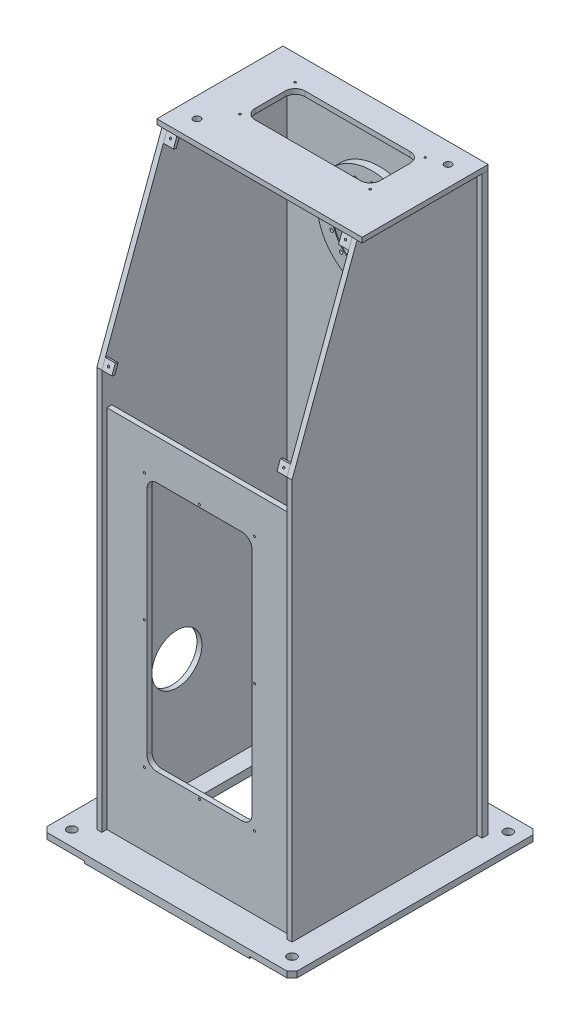
from build123d import *

# Parameters (mm, degrees)
SKETCH_1_W                   = 410
SKETCH_1_H                   = 1150
EXTRUDE_1_DEPTH              = 12
SKETCH_2_W                   = 10
SKETCH_2_H                   = 1150
EXTRUDE_2_DEPTH              = 370
EXTRUDE_2_2_DEPTH            = 370
SKETCH_3_R                   = 110
CUT_EXTRUDE_1_DEPTH          = 400
EXTRUDE_3_DEPTH              = 15
EXTRUDE_3_DEPTH_BACK         = 12
SKETCH_4_R                   = 110
SKETCH_4_R_2                 = 80
SKETCH_7_W                   = 3.4
SKETCH_7_H                   = 27
PATTERN_CIRCULAR_1_COUNT     = 16
SKETCH_9_W                   = 500
SKETCH_9_H                   = 492
EXTRUDE_4_DEPTH              = 16
SKETCH_10_W                  = 300
SKETCH_10_H                  = 250
CUT_EXTRUDE_2_DEPTH          = 16
CHAMFER_1_SIZE               = 10
FILLET_1_R                   = 20
SKETCH_11_W                  = 8
SKETCH_11_H                  = 69
EXTRUDE_5_DEPTH              = 150
EXTRUDE_5_2_DEPTH            = 150
CUT_EXTRUDE_START            = -283
CUT_EXTRUDE_3_DEPTH          = 410
CUT_EXTRUDE_4_DEPTH          = 860.229305832
SKETCH_14_W                  = 370
SKETCH_14_H                  = 10
EXTRUDE_6_DEPTH              = 730
SKETCH_15_W                  = 410
SKETCH_15_H                  = 252
EXTRUDE_7_DEPTH              = 10
SKETCH_16_W                  = 210
SKETCH_16_H                  = 500
CUT_EXTRUDE_5_DEPTH          = 10
CHAMFER_3_SIZE               = 1
SKETCH_17_W                  = 250
SKETCH_17_H                  = 100
CUT_EXTRUDE_6_DEPTH          = 10
FILLET_2_R                   = 20
SKETCH_21_R                  = 9
CUT_EXTRUDE_8_DEPTH          = 1265.543000455
HOLE_WIZARD_M5_1_AT_2_COUNT  = 2
HOLE_WIZARD_M5_1_AT_2_PITCH  = 255
HOLE_WIZARD_M5_1_AT_3_COUNT  = 2
HOLE_WIZARD_M5_1_AT_3_PITCH  = 510
HOLE_WIZARD_M5_1_AT_4_COUNT  = 2
HOLE_WIZARD_M5_1_AT_4_PITCH  = 521.72789843
HOLE_WIZARD_M5_1_AT_5_COUNT  = 2
HOLE_WIZARD_M5_1_AT_5_PITCH  = 555.42776308
HOLE_WIZARD_M5_1_AT_6_COUNT  = 2
HOLE_WIZARD_M5_1_AT_6_PITCH  = 336.786282381
HOLE_WIZARD_M5_1_AT_7_COUNT  = 2
HOLE_WIZARD_M5_1_AT_7_PITCH  = 220
HOLE_WIZARD_M5_1_AT_8_COUNT  = 2
HOLE_WIZARD_M5_1_AT_8_PITCH  = 110
FILLET_3_R                   = 20
HOLE_WIZARD_M5_2_AT_2_COUNT  = 2
HOLE_WIZARD_M5_2_AT_2_PITCH  = 110
HOLE_WIZARD_M5_2_AT_3_COUNT  = 2
HOLE_WIZARD_M5_2_AT_3_PITCH  = 282.31188427
HOLE_WIZARD_M5_2_AT_4_COUNT  = 2
HOLE_WIZARD_M5_2_AT_4_PITCH  = 260
HOLE_WIZARD_M16_1_AT_2_COUNT = 2
HOLE_WIZARD_M16_1_AT_2_PITCH = 372.134384329
SKETCH_31_W                  = 40
SKETCH_31_H                  = 30
EXTRUDE_8_DEPTH              = 10
EXTRUDE_8_2_DEPTH            = 10
HOLE_WIZARD_M16_3_AT_2_COUNT = 2
HOLE_WIZARD_M16_3_AT_2_PITCH = 372.832034102
SKETCH_41_R                  = 50
CUT_EXTRUDE_10_DEPTH         = 855.093086262
SKETCH_40_OUTSIDE_W          = 775.864
SKETCH_40_OUTSIDE_H          = 767.864
SKETCH_40_OUTSIDE_W_2        = 330
SKETCH_40_OUTSIDE_H_2        = 492
CUT_EXTRUDE_9_DEPTH          = 4
SKETCH_42_W                  = 20
SKETCH_42_H                  = 20
EXTRUDE_9_DEPTH              = 6
EXTRUDE_9_2_DEPTH            = 6
EXTRUDE_9_3_DEPTH            = 6
EXTRUDE_9_4_DEPTH            = 6
HOLE_WIZARD_M5_3_AT_2_COUNT  = 2
HOLE_WIZARD_M5_3_AT_2_PITCH  = 355
HOLE_WIZARD_M5_3_AT_3_COUNT  = 2
HOLE_WIZARD_M5_3_AT_3_PITCH  = 498.522817933
HOLE_WIZARD_M5_3_AT_4_COUNT  = 2
HOLE_WIZARD_M5_3_AT_4_PITCH  = 350


with BuildPart() as part:
    # 草图1 → 凸台-拉伸1 (new body)
    with BuildSketch(Plane.XY):
        Rectangle(SKETCH_1_W, SKETCH_1_H)
    extrude(amount=EXTRUDE_1_DEPTH)

    # 草图3 → 切除-拉伸1 (cut)
    with BuildSketch(Plane(origin=(0, 0, 0), x_dir=(-1, 0, 0), z_dir=(0, 0, -1))):
        with Locations((0, 375)):
            Circle(SKETCH_3_R)
    extrude(amount=-CUT_EXTRUDE_1_DEPTH, mode=Mode.SUBTRACT)


with BuildPart() as body_2:
    # 草图2 → 凸台-拉伸2 (new body)
    with BuildSketch(Plane.XY.offset(12)):
        with Locations((190, 0)):
            Rectangle(SKETCH_2_W, SKETCH_2_H)
    extrude(amount=EXTRUDE_2_DEPTH)


with BuildPart() as body_3:
    # 草图2 → Extrude 2 2 (new body)
    with BuildSketch(Plane.XY.offset(12)):
        with Locations((-190, 0)):
            Rectangle(SKETCH_2_W, SKETCH_2_H)
    extrude(amount=EXTRUDE_2_2_DEPTH)


with BuildPart() as body_4:
    # 草图4 → 凸台-拉伸3 (new, two sides: drawn at the far end of the back side and taken through both)
    with BuildSketch(Plane.XY.offset(12).offset(-EXTRUDE_3_DEPTH_BACK)):
        with Locations((0, 375)):
            Circle(SKETCH_4_R)
        with Locations((0, 375)):
            Circle(SKETCH_4_R_2, mode=Mode.SUBTRACT)
    extrude(amount=EXTRUDE_3_DEPTH + EXTRUDE_3_DEPTH_BACK)

    # 草图7 → M8 螺纹孔1 (revolve, cut)
    with BuildSketch(Plane(origin=(0, 462.5, 27), x_dir=(0, -1, 0), z_dir=(1, 0, 0))):
        with Locations((1.7, 13.5)):
            Rectangle(SKETCH_7_W, SKETCH_7_H)
    hole_wizard_m8_1 = revolve(axis=Axis((0, 462.5, 33.35), (0, 0, -1)), mode=Mode.SUBTRACT)

    # 阵列(圆周)1: M8 螺纹孔1 ×16 about axis
    pattern_circular_1_axis = Axis((0, 375, 0), (0, 0, 1))
    for i in range(1, PATTERN_CIRCULAR_1_COUNT):
        add(hole_wizard_m8_1.rotate(pattern_circular_1_axis, i * 360 / PATTERN_CIRCULAR_1_COUNT), mode=Mode.SUBTRACT)

    # 倒角3
    chamfer_3_edges = [body_4.edges().sort_by_distance(p)[0] for p in [
        (-80, 375, 27),
    ]]
    chamfer(chamfer_3_edges, length=CHAMFER_3_SIZE)


with BuildPart() as body_5:
    # 草图9 → 凸台-拉伸4 (new body)
    with BuildSketch(Plane.XZ.offset(575)):
        with Locations((0, 191)):
            Rectangle(SKETCH_9_W, SKETCH_9_H)
    extrude(amount=EXTRUDE_4_DEPTH)

    # 草图10 → 切除-拉伸2 (cut)
    with BuildSketch(Plane.XZ.offset(591)):
        with Locations((0, 206)):
            Rectangle(SKETCH_10_W, SKETCH_10_H)
    extrude(amount=-CUT_EXTRUDE_2_DEPTH, mode=Mode.SUBTRACT)

    # 倒角1
    chamfer_1_edges = [body_5.edges().sort_by_distance(p)[0] for p in [
        (-250, -583, 437),
        (250, -583, 437),
        (250, -583, -55),
        (-250, -583, -55),
    ]]
    chamfer(chamfer_1_edges, length=CHAMFER_1_SIZE)

    # 圆角1
    fillet_1_edges = [body_5.edges().sort_by_distance(p)[0] for p in [
        (150, -583, 331),
        (150, -583, 81),
        (-150, -583, 81),
        (-150, -583, 331),
    ]]
    fillet(fillet_1_edges, radius=FILLET_1_R)

    # 草图21 → 切除-拉伸8 (cut, through all)
    with BuildSketch(Plane(origin=(0, -575, 0), x_dir=(1, 0, 0), z_dir=(0, 1, 0))):
        with Locations(Location((-220, 25, 0), (0, 0, 270))):
            Circle(SKETCH_21_R)
        with Locations(Location((-220, -407, 0), (0, 0, 270))):
            Circle(SKETCH_21_R)
        with Locations(Location((220, -407, 0), (0, 0, 270))):
            Circle(SKETCH_21_R)
        with Locations(Location((220, 25, 0), (0, 0, 270))):
            Circle(SKETCH_21_R)
    extrude(amount=-CUT_EXTRUDE_8_DEPTH, mode=Mode.SUBTRACT)

    # 草图40 outside → 切除-拉伸9 (cut)
    with BuildSketch(Plane.XZ.offset(591)):
        with Locations((0, 191)):
            Rectangle(SKETCH_40_OUTSIDE_W, SKETCH_40_OUTSIDE_H)
        with Locations((0, 191)):
            Rectangle(SKETCH_40_OUTSIDE_W_2, SKETCH_40_OUTSIDE_H_2, mode=Mode.SUBTRACT)
    extrude(amount=-CUT_EXTRUDE_9_DEPTH, mode=Mode.SUBTRACT)


with BuildPart() as body_6:
    # 草图11 → 凸台-拉伸5 (new body)
    with BuildSketch(Plane(origin=(0, -575, 0), x_dir=(1, 0, 0), z_dir=(0, 1, 0))):
        with Locations((-74, -46.5)):
            Rectangle(SKETCH_11_W, SKETCH_11_H)
    extrude(amount=EXTRUDE_5_DEPTH)


with BuildPart() as body_7:
    # 草图11 → Extrude 5 2 (new body)
    with BuildSketch(Plane(origin=(0, -575, 0), x_dir=(1, 0, 0), z_dir=(0, 1, 0))):
        with Locations((74, -46.5)):
            Rectangle(SKETCH_11_W, SKETCH_11_H)
    extrude(amount=EXTRUDE_5_2_DEPTH)


with BuildPart() as cut_extrude_3_tool:
    # 草图12 → 切除-拉伸3 (new body)
    with BuildSketch(Plane(origin=(78, 0, 0), x_dir=(0, 0, -1), z_dir=(1, 0, 0)).offset(CUT_EXTRUDE_START)):
        Polygon((-12, -575), (-12, -495), (-17, -575), align=None)
        Polygon((-81, -480), (-31, -425), (-81, -425), align=None)
    extrude(amount=CUT_EXTRUDE_3_DEPTH)


with BuildPart() as body_6_1:
    add(body_6.part)

    # 切除-拉伸3: cut by cut_extrude_3_tool
    add(cut_extrude_3_tool.part, mode=Mode.SUBTRACT)


with BuildPart() as body_7_1:
    add(body_7.part)

    # 切除-拉伸3: cut by cut_extrude_3_tool
    add(cut_extrude_3_tool.part, mode=Mode.SUBTRACT)


with BuildPart() as cut_extrude_4_tool:
    # 草图13 → 切除-拉伸4 (new, through all)
    with BuildSketch(Plane(origin=(195, 0, 0), x_dir=(0, 0, -1), z_dir=(1, 0, 0))):
        Polygon((-252, 575), (-382, 575), (-382, 225), align=None)
    extrude(amount=-CUT_EXTRUDE_4_DEPTH)


with BuildPart() as body_2_1:
    add(body_2.part)

    # 切除-拉伸4: cut by cut_extrude_4_tool
    add(cut_extrude_4_tool.part, mode=Mode.SUBTRACT)


with BuildPart() as body_3_1:
    add(body_3.part)

    # 切除-拉伸4: cut by cut_extrude_4_tool
    add(cut_extrude_4_tool.part, mode=Mode.SUBTRACT)

    # 草图41 → 切除-拉伸10 (cut, through all)
    with BuildSketch(Plane(origin=(-185, 0, 0), x_dir=(0, 0, -1), z_dir=(1, 0, 0))):
        with Locations((-232, -350)):
            Circle(SKETCH_41_R)
    extrude(amount=-CUT_EXTRUDE_10_DEPTH, mode=Mode.SUBTRACT)


with BuildPart() as body_8:
    # 草图14 → 凸台-拉伸6 (new body)
    with BuildSketch(Plane(origin=(0, -575, 0), x_dir=(1, 0, 0), z_dir=(0, 1, 0))):
        with Locations((0, -367)):
            Rectangle(SKETCH_14_W, SKETCH_14_H)
    extrude(amount=EXTRUDE_6_DEPTH)

    # 草图16 → 切除-拉伸5 (cut)
    with BuildSketch(Plane.XY.offset(372)):
        with Locations((0, -175)):
            Rectangle(SKETCH_16_W, SKETCH_16_H)
    extrude(amount=-CUT_EXTRUDE_5_DEPTH, mode=Mode.SUBTRACT)

    # 草图22 → M5 螺纹孔1 (revolve, cut)
    with BuildSketch(Plane(origin=(-110, 80, 372), x_dir=(0, -1, 0), z_dir=(1, 0, 0))):
        Polygon((0, 0), (0, 13.6618073), (2.1, 12.4), (2.1, 0), align=None)
    hole_wizard_m5_1 = revolve(axis=Axis((-110, 80, 378.35), (0, 0, -1)), mode=Mode.SUBTRACT)

    # M5 螺纹孔1 at 2: M5 螺纹孔1 ×2
    with Locations(*[(0, -i * HOLE_WIZARD_M5_1_AT_2_PITCH, 0) for i in range(1, HOLE_WIZARD_M5_1_AT_2_COUNT)]):
        add(hole_wizard_m5_1, mode=Mode.SUBTRACT)

    # M5 螺纹孔1 at 3: M5 螺纹孔1 ×2
    with Locations(*[(0, -i * HOLE_WIZARD_M5_1_AT_3_PITCH, 0) for i in range(1, HOLE_WIZARD_M5_1_AT_3_COUNT)]):
        add(hole_wizard_m5_1, mode=Mode.SUBTRACT)

    # M5 螺纹孔1 at 4: M5 螺纹孔1 ×2
    with Locations(*[Vector(0.21083787225305148, -0.9775210440823288, 0) * (i * HOLE_WIZARD_M5_1_AT_4_PITCH) for i in range(1, HOLE_WIZARD_M5_1_AT_4_COUNT)]):
        add(hole_wizard_m5_1, mode=Mode.SUBTRACT)

    # M5 螺纹孔1 at 5: M5 螺纹孔1 ×2
    with Locations(*[Vector(0.3960911114346505, -0.9182112128712344, 0) * (i * HOLE_WIZARD_M5_1_AT_5_PITCH) for i in range(1, HOLE_WIZARD_M5_1_AT_5_COUNT)]):
        add(hole_wizard_m5_1, mode=Mode.SUBTRACT)

    # M5 螺纹孔1 at 6: M5 螺纹孔1 ×2
    with Locations(*[Vector(0.6532332565467511, -0.7571567291791882, 0) * (i * HOLE_WIZARD_M5_1_AT_6_PITCH) for i in range(1, HOLE_WIZARD_M5_1_AT_6_COUNT)]):
        add(hole_wizard_m5_1, mode=Mode.SUBTRACT)

    # M5 螺纹孔1 at 7: M5 螺纹孔1 ×2
    with Locations(*[(i * HOLE_WIZARD_M5_1_AT_7_PITCH, 0, 0) for i in range(1, HOLE_WIZARD_M5_1_AT_7_COUNT)]):
        add(hole_wizard_m5_1, mode=Mode.SUBTRACT)

    # M5 螺纹孔1 at 8: M5 螺纹孔1 ×2
    with Locations(*[(i * HOLE_WIZARD_M5_1_AT_8_PITCH, 0, 0) for i in range(1, HOLE_WIZARD_M5_1_AT_8_COUNT)]):
        add(hole_wizard_m5_1, mode=Mode.SUBTRACT)

    # 圆角3
    fillet_3_edges = [body_8.edges().sort_by_distance(p)[0] for p in [
        (105, 75, 367),
        (105, -425, 367),
        (-105, -425, 367),
        (-105, 75, 367),
    ]]
    fillet(fillet_3_edges, radius=FILLET_3_R)


with BuildPart() as body_9:
    # 草图15 → 凸台-拉伸7 (new body)
    with BuildSketch(Plane(origin=(0, 575, 0), x_dir=(1, 0, 0), z_dir=(0, 1, 0))):
        with Locations((0, -126)):
            Rectangle(SKETCH_15_W, SKETCH_15_H)
    extrude(amount=EXTRUDE_7_DEPTH)

    # 草图17 → 切除-拉伸6 (cut)
    with BuildSketch(Plane(origin=(0, 585, 0), x_dir=(1, 0, 0), z_dir=(0, 1, 0))):
        with Locations((0, -105.740281061)):
            Rectangle(SKETCH_17_W, SKETCH_17_H)
    extrude(amount=-CUT_EXTRUDE_6_DEPTH, mode=Mode.SUBTRACT)

    # 圆角2
    fillet_2_edges = [body_9.edges().sort_by_distance(p)[0] for p in [
        (125, 580, 55.740281061),
        (125, 580, 155.740281061),
        (-125, 580, 155.740281061),
        (-125, 580, 55.740281061),
    ]]
    fillet(fillet_2_edges, radius=FILLET_2_R)

    # 草图24 → M5 螺纹孔2 (revolve, cut)
    with BuildSketch(Plane(origin=(-130, 585, 160.740281061), x_dir=(0, 0, 1), z_dir=(1, 0, 0))):
        Polygon((0, 0), (0, 13.6618073), (2.1, 12.4), (2.1, 0), align=None)
    hole_wizard_m5_2 = revolve(axis=Axis((-130, 591.35, 160.740281061), (0, -1, 0)), mode=Mode.SUBTRACT)

    # M5 螺纹孔2 at 2: M5 螺纹孔2 ×2
    with Locations(*[(0, 0, -i * HOLE_WIZARD_M5_2_AT_2_PITCH) for i in range(1, HOLE_WIZARD_M5_2_AT_2_COUNT)]):
        add(hole_wizard_m5_2, mode=Mode.SUBTRACT)

    # M5 螺纹孔2 at 3: M5 螺纹孔2 ×2
    with Locations(*[Vector(0.9209672510685588, 0, -0.3896399908366981) * (i * HOLE_WIZARD_M5_2_AT_3_PITCH) for i in range(1, HOLE_WIZARD_M5_2_AT_3_COUNT)]):
        add(hole_wizard_m5_2, mode=Mode.SUBTRACT)

    # M5 螺纹孔2 at 4: M5 螺纹孔2 ×2
    with Locations(*[(i * HOLE_WIZARD_M5_2_AT_4_PITCH, 0, 0) for i in range(1, HOLE_WIZARD_M5_2_AT_4_COUNT)]):
        add(hole_wizard_m5_2, mode=Mode.SUBTRACT)

    # 草图26 → M16 螺纹孔1 (revolve, cut)
    with BuildSketch(Plane(origin=(-165, 585, 212), x_dir=(0, 0, 1), z_dir=(1, 0, 0))):
        Polygon((0, 0), (0, 42.206024333), (7, 38), (7, 0), align=None)
    hole_wizard_m16_1 = revolve(axis=Axis((-165, 591.35, 212), (0, -1, 0)), mode=Mode.SUBTRACT)

    # M16 螺纹孔1 at 2: M16 螺纹孔1 ×2
    with Locations(*[Vector(0.8867764278082937, 0, -0.4621986229788685) * (i * HOLE_WIZARD_M16_1_AT_2_PITCH) for i in range(1, HOLE_WIZARD_M16_1_AT_2_COUNT)]):
        add(hole_wizard_m16_1, mode=Mode.SUBTRACT)


with BuildPart() as body_10:
    # 草图31 → 凸台-拉伸8 (new body)
    with BuildSketch(Plane.XZ.offset(-575)):
        with Locations((-165, 212)):
            Rectangle(SKETCH_31_W, SKETCH_31_H)
    extrude(amount=EXTRUDE_8_DEPTH)


with BuildPart() as body_11:
    # 草图31 → Extrude 8 2 (new body)
    with BuildSketch(Plane.XZ.offset(-575)):
        with Locations((175, 40)):
            Rectangle(SKETCH_31_W, SKETCH_31_H)
    extrude(amount=EXTRUDE_8_2_DEPTH)

    # 草图36 → M16 螺纹孔3 (revolve, cut)
    with BuildSketch(Plane(origin=(165, 575, 38.495747452), x_dir=(0, 0, 1), z_dir=(1, 0, 0))):
        Polygon((0, 0), (0, 42.206024333), (7, 38), (7, 0), align=None)
    hole_wizard_m16_3 = revolve(axis=Axis((165, 581.35, 38.495747452), (0, -1, 0)), mode=Mode.SUBTRACT)


with BuildPart() as body_10_1:
    add(body_10.part)

    # M16 螺纹孔3 at 2: M16 螺纹孔3 ×2
    with Locations(*[Vector(-0.8851170763670309, 0, 0.46536841440248167) * (i * HOLE_WIZARD_M16_3_AT_2_PITCH) for i in range(1, HOLE_WIZARD_M16_3_AT_2_COUNT)]):
        add(hole_wizard_m16_3, mode=Mode.SUBTRACT)


with BuildPart() as body_12:
    # 草图42 → 凸台-拉伸9 (new body)
    with BuildSketch(Plane(origin=(0, 151.961979914, 409.128407461), x_dir=(1, 0, 0), z_dir=(0, 0.34818652960362717, 0.9374252720097654))):
        with Locations((-175, 441.276525946)):
            Rectangle(SKETCH_42_W, SKETCH_42_H)
    extrude(amount=-EXTRUDE_9_DEPTH)


with BuildPart() as body_13:
    # 草图42 → Extrude 9 2 (new body)
    with BuildSketch(Plane(origin=(0, 151.961979914, 409.128407461), x_dir=(1, 0, 0), z_dir=(0, 0.34818652960362717, 0.9374252720097654))):
        with Locations((-175, 87.913431894)):
            Rectangle(SKETCH_42_W, SKETCH_42_H)
    extrude(amount=-EXTRUDE_9_2_DEPTH)

    # 草图49 → M5 螺纹孔3 (revolve, cut)
    with BuildSketch(Plane(origin=(-175, 234.37425272, 378.518134704), x_dir=(0, -0.9374252720097652, 0.34818652960362767), z_dir=(1, 0, 0))):
        Polygon((0, 0), (0, 15.2618073), (2.1, 14), (2.1, 0), align=None)
    hole_wizard_m5_3 = revolve(axis=Axis((-175, 236.585237183, 384.470785181), (0, -0.34818652960362745, -0.9374252720097652)), mode=Mode.SUBTRACT)


with BuildPart() as body_14:
    # 草图42 → Extrude 9 3 (new body)
    with BuildSketch(Plane(origin=(0, 151.961979914, 409.128407461), x_dir=(1, 0, 0), z_dir=(0, 0.34818652960362717, 0.9374252720097654))):
        with Locations((175, 87.913431894)):
            Rectangle(SKETCH_42_W, SKETCH_42_H)
    extrude(amount=-EXTRUDE_9_3_DEPTH)

    # M5 螺纹孔3 at 4: M5 螺纹孔3 ×2
    with Locations(*[(i * HOLE_WIZARD_M5_3_AT_4_PITCH, 0, 0) for i in range(1, HOLE_WIZARD_M5_3_AT_4_COUNT)]):
        add(hole_wizard_m5_3, mode=Mode.SUBTRACT)


with BuildPart() as body_15:
    # 草图42 → Extrude 9 4 (new body)
    with BuildSketch(Plane(origin=(0, 151.961979914, 409.128407461), x_dir=(1, 0, 0), z_dir=(0, 0.34818652960362717, 0.9374252720097654))):
        with Locations((175, 441.276525946)):
            Rectangle(SKETCH_42_W, SKETCH_42_H)
    extrude(amount=-EXTRUDE_9_4_DEPTH)

    # M5 螺纹孔3 at 3: M5 螺纹孔3 ×2
    with Locations(*[Vector(0.7020741827848285, 0.6675441115076456, -0.24794495570284006) * (i * HOLE_WIZARD_M5_3_AT_3_PITCH) for i in range(1, HOLE_WIZARD_M5_3_AT_3_COUNT)]):
        add(hole_wizard_m5_3, mode=Mode.SUBTRACT)


with BuildPart() as body_12_1:
    add(body_12.part)

    # M5 螺纹孔3 at 2: M5 螺纹孔3 ×2
    with Locations(*[Vector(0, 0.9374252720097652, -0.34818652960362745) * (i * HOLE_WIZARD_M5_3_AT_2_PITCH) for i in range(1, HOLE_WIZARD_M5_3_AT_2_COUNT)]):
        add(hole_wizard_m5_3, mode=Mode.SUBTRACT)


solid = Compound([part.part, body_4.part, body_5.part, body_6_1.part, body_7_1.part, body_2_1.part, body_3_1.part, body_8.part, body_9.part, body_11.part, body_10_1.part, body_13.part, body_14.part, body_15.part, body_12_1.part])
